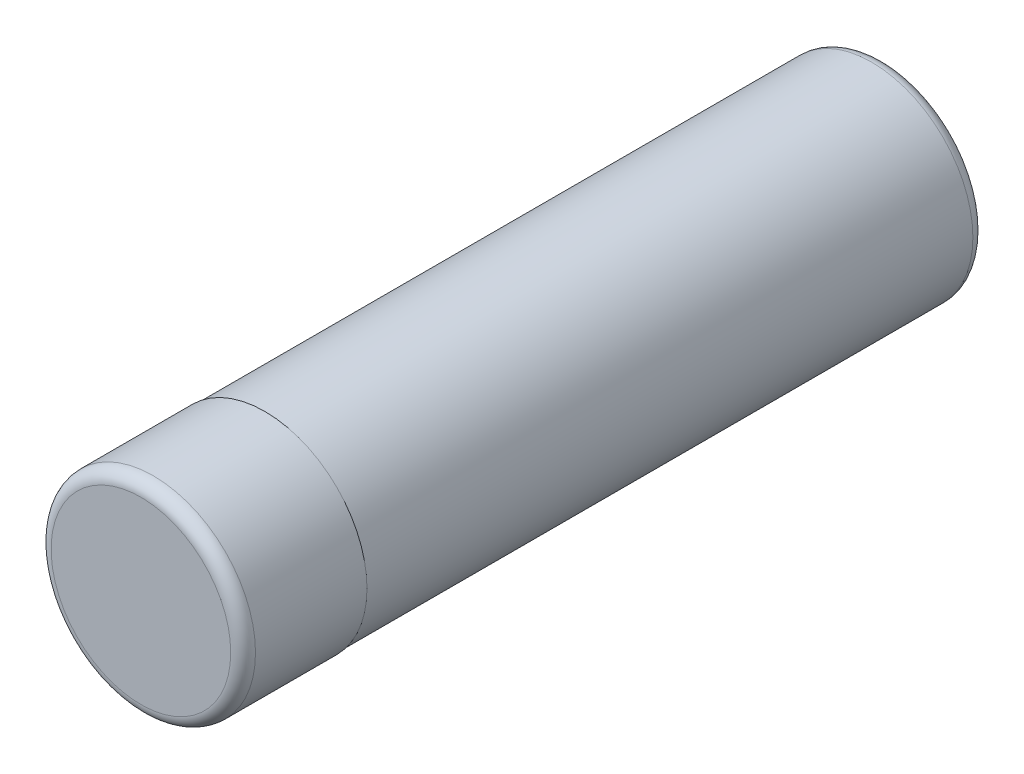
from build123d import *

# Parameters (mm, degrees)
SKETCH_1_R      = 2.45
EXTRUDE_1_DEPTH = 15
SKETCH_2_R      = 2.475
EXTRUDE_2_DEPTH = 3
FILLET_1_R      = 0.3
FILLET_2_R      = 0.3


with BuildPart() as part:
    # 스케치1 → 보스-돌출1 (new body)
    with BuildSketch(Plane.XY):
        Circle(SKETCH_1_R)
    extrude(amount=EXTRUDE_1_DEPTH)

    # 스케치2 → 보스-돌출2 (add)
    with BuildSketch(Plane.XY.offset(15)):
        Circle(SKETCH_2_R)
    extrude(amount=EXTRUDE_2_DEPTH)

    # 필렛1
    fillet_1_edges = [part.edges().sort_by_distance(p)[0] for p in [
        (-2.475, 0, 18),
    ]]
    fillet(fillet_1_edges, radius=FILLET_1_R)

    # 필렛2
    fillet_2_edges = [part.edges().sort_by_distance(p)[0] for p in [
        (-2.45, 0, 0),
    ]]
    fillet(fillet_2_edges, radius=FILLET_2_R)


solid = part.part
